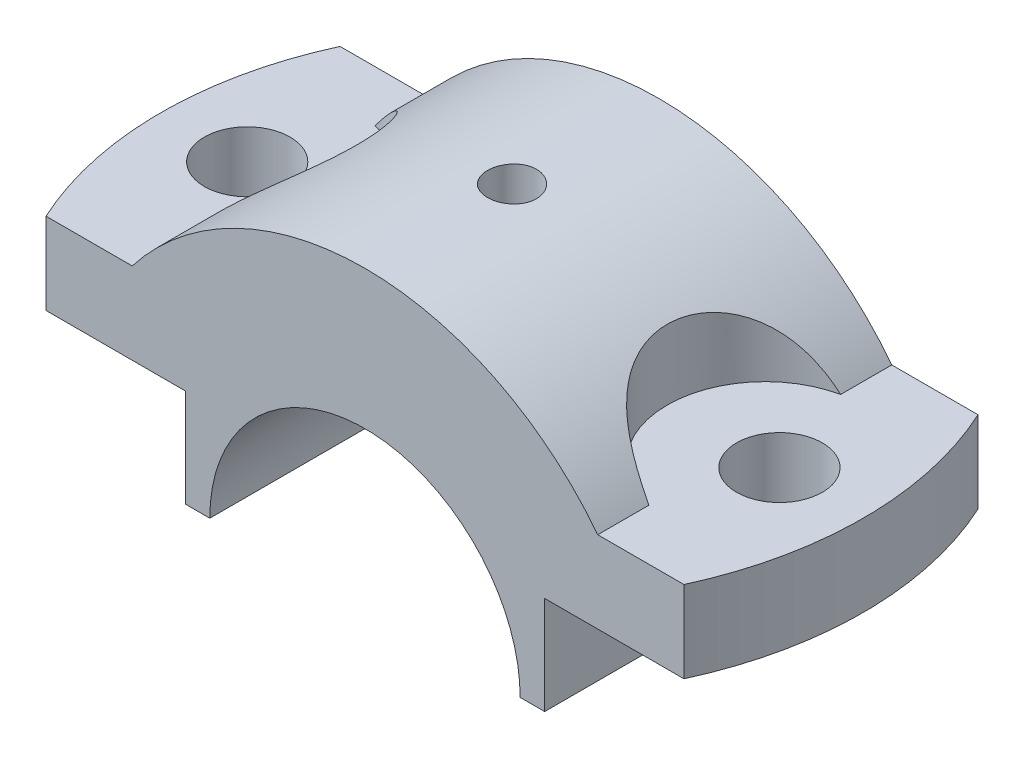
from build123d import *

# Parameters (mm, degrees)
BOSS_EXTRUDE1_DEPTH      = 36
CUT_EXTRUDE1_DEPTH       = 36
SKETCH3_R                = 12
CUT_EXTRUDE10_DEPTH      = 61.241181927
SKETCH10_R               = 3
CUT_EXTRUDE12_DEPTH      = 10
CUT_EXTRUDE13_DEPTH      = 61.241181987
CUT_EXTRUDE13_DEPTH_BACK = 61.241181987
SKETCH11_R               = 1.5
SKETCH9_R                = 5.25
CUT_EXTRUDE14_DEPTH      = 10


with BuildPart() as part:
    # Sketch1 → Boss-Extrude1 (new body)
    with BuildSketch(Plane.XY):
        with BuildLine():
            Line((-22, 0), (-19, 0))
            ThreePointArc((-19, 0), (0, 19), (19, 0))
            Line((19, 0), (22, 0))
            Line((22, 0), (22, 12))
            Line((22, 12), (43, 12))
            Line((43, 12), (43, 22))
            Line((43, 22), (28.495613698, 22))
            ThreePointArc((28.495613698, 22), (0, 36), (-28.495613698, 22))
            Line((-28.495613698, 22), (-43, 22))
            Line((-43, 22), (-43, 12))
            Line((-43, 12), (-22, 12))
            Line((-22, 12), (-22, 0))
        make_face()
    extrude(amount=-BOSS_EXTRUDE1_DEPTH)

    # Sketch2 → Cut-Extrude1 (cut)
    with BuildSketch(Plane(origin=(0, 22, 0), x_dir=(1, 0, 0), z_dir=(0, 1, 0))):
        with BuildLine():
            Line((-39.05124838, 36), (-43, 36))
            Line((-43, 36), (-43, 18))
            ThreePointArc((-43, 18), (-42.001212365, 27.214019744), (-39.05124838, 36))
        make_face()
        with BuildLine():
            ThreePointArc((-39.05124838, 0), (-42.001212365, 8.785980256), (-43, 18))
            Line((-43, 18), (-43, 0))
            Line((-43, 0), (-39.05124838, 0))
        make_face()
        with BuildLine():
            Line((43, 36), (39.05124838, 36))
            ThreePointArc((39.05124838, 36), (42.001212365, 27.214019744), (43, 18))
            Line((43, 18), (43, 36))
        make_face()
        with BuildLine():
            Line((43, 0), (43, 18))
            ThreePointArc((43, 18), (42.001212365, 8.785980256), (39.05124838, 0))
            Line((39.05124838, 0), (43, 0))
        make_face()
    extrude(amount=-CUT_EXTRUDE1_DEPTH, mode=Mode.SUBTRACT)

    # Sketch3 → Cut-Extrude10 (cut, through all)
    with BuildSketch(Plane(origin=(0, 22, 0), x_dir=(1, 0, 0), z_dir=(0, 1, 0))):
        with Locations((-31, 18)):
            Circle(SKETCH3_R)
        with Locations((31, 18)):
            Circle(SKETCH3_R)
    extrude(amount=CUT_EXTRUDE10_DEPTH, mode=Mode.SUBTRACT)

    # Sketch10 → Cut-Extrude12 (cut)
    with BuildSketch(Plane(origin=(0, 36, 0), x_dir=(1, 0, 0), z_dir=(0, 1, 0))):
        with Locations(Location((0, 18, 0), (0, 0, 180))):
            Circle(SKETCH10_R)
    extrude(amount=-CUT_EXTRUDE12_DEPTH, mode=Mode.SUBTRACT)

    # Sketch11 → Cut-Extrude13 (cut, two sides: drawn at the far end of the back side and taken through both)
    with BuildSketch(Plane(origin=(0, 22, 0), x_dir=(1, 0, 0), z_dir=(0, 1, 0)).offset(-CUT_EXTRUDE13_DEPTH_BACK)):
        with Locations(Location((0, 18, 0), (0, 0, 270))):
            Circle(SKETCH11_R)
    extrude(amount=CUT_EXTRUDE13_DEPTH + CUT_EXTRUDE13_DEPTH_BACK, mode=Mode.SUBTRACT)

    # Sketch9 → Cut-Extrude14 (cut)
    with BuildSketch(Plane(origin=(0, 22, 0), x_dir=(1, 0, 0), z_dir=(0, 1, 0))):
        with Locations(Location((-32.500715047, 18.084858078, 0), (0, 0, 270))):
            Circle(SKETCH9_R)
        with Locations(Location((32.499093077, 18.242794562, 0), (0, 0, 270))):
            Circle(SKETCH9_R)
    extrude(amount=-CUT_EXTRUDE14_DEPTH, mode=Mode.SUBTRACT)


solid = part.part
